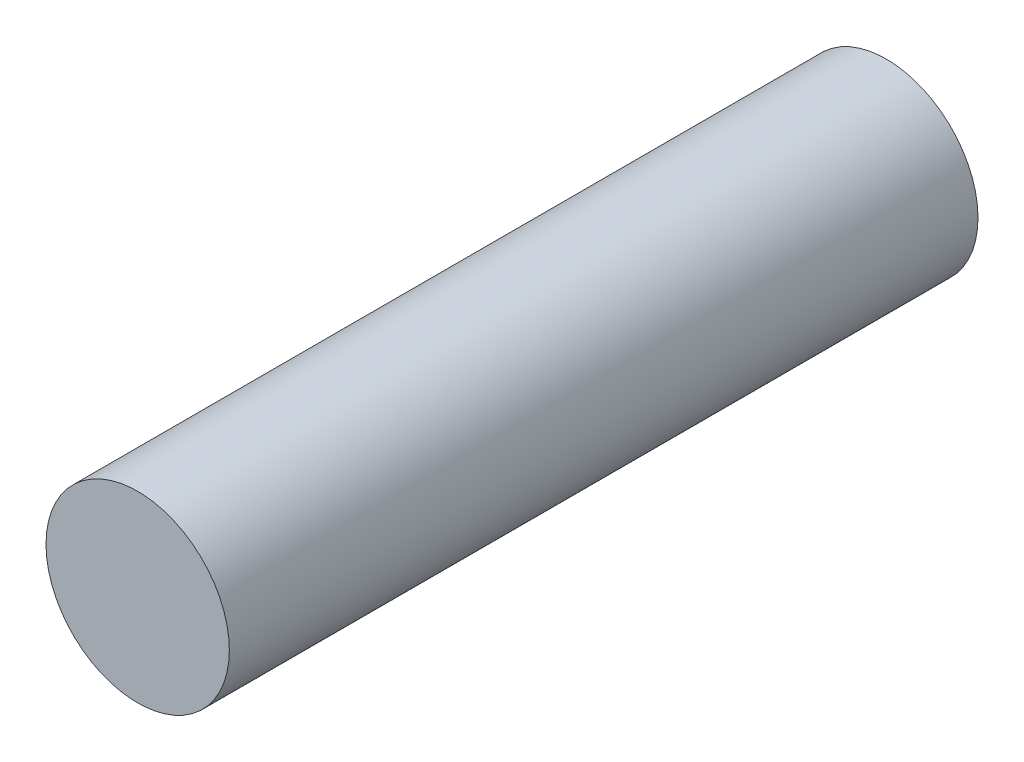
from build123d import *

# Parameters (mm, degrees)
ESQUISSE1_R      = 3.11
EXTRUSION1_DEPTH = 25.4


with BuildPart() as part:
    # Esquisse1 → Extrusion1 (new body)
    with BuildSketch(Plane.XY):
        Circle(ESQUISSE1_R)
    extrude(amount=EXTRUSION1_DEPTH)


solid = part.part
